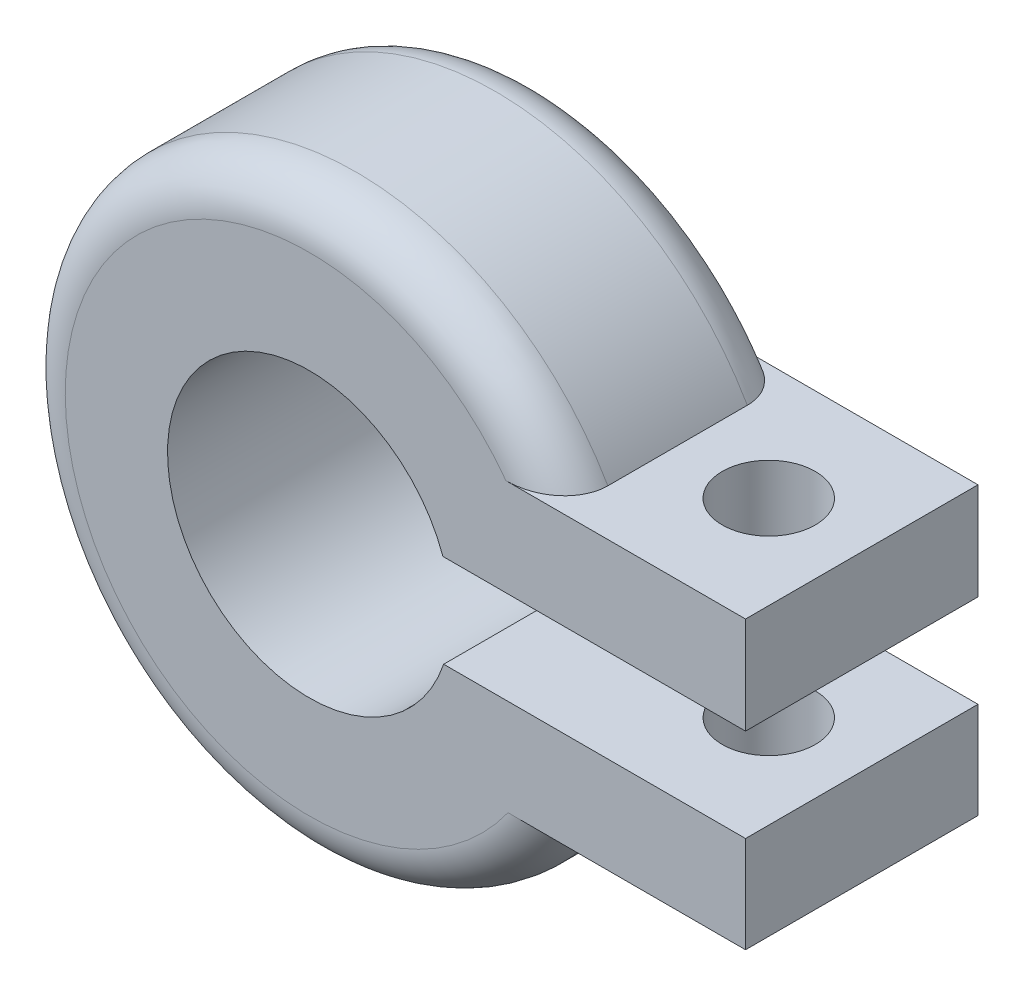
from build123d import *

# Parameters (mm, degrees)
BOSS_EXTRUDE1_DEPTH     = 5
FILLET3_R               = 1
FILLET4_R               = 1
CUT_EXTRUDE1_DEPTH      = 13.854889966
CUT_EXTRUDE1_DEPTH_BACK = 13.854889966
SKETCH2_R               = 1


with BuildPart() as part:
    # Sketch1 → Boss-Extrude1 (new body)
    with BuildSketch(Plane(origin=(0, 0, 0), x_dir=(0, 1, 0), z_dir=(0, 0, 1))):
        with BuildLine():
            Line((-0.977144637, -2.88923664), (-0.977144637, -6.118433409))
            Line((-0.977144637, -6.118433409), (-0.977144637, -9.381714775))
            Line((-0.977144637, -9.381714775), (-3.05, -9.381714775))
            Line((-3.05, -9.381714775), (-3.05, -5.455272679))
            ThreePointArc((-3.05, -5.455272679), (-0.035341977, 6.249900075), (3.1115, -5.420430587))
            Line((3.1115, -5.420430587), (3.1115, -9.381714775))
            Line((3.1115, -9.381714775), (1.022855363, -9.381714775))
            Line((1.022855363, -9.381714775), (1.022855363, -6.104337812))
            Line((1.022855363, -6.104337812), (1.022855363, -2.873372044))
            ThreePointArc((1.022855363, -2.873372044), (-0.024192746, 3.049904049), (-0.977144637, -2.88923664))
        make_face()
    extrude(amount=BOSS_EXTRUDE1_DEPTH)

    # Fillet3
    fillet3_edges = [part.edges().sort_by_distance(p)[0] for p in [
        (-6.249900075, -0.035341977, 5),
    ]]
    fillet(fillet3_edges, radius=FILLET3_R)

    # Fillet4
    fillet4_edges = [part.edges().sort_by_distance(p)[0] for p in [
        (-6.249900075, -0.035341977, 0),
    ]]
    fillet(fillet4_edges, radius=FILLET4_R)

    # Sketch2 → Cut-Extrude1 (cut, two sides: drawn at the far end of the back side and taken through both)
    with BuildSketch(Plane(origin=(0, -0.977144637, 0), x_dir=(-1, 0, 0), z_dir=(0, 1, 0)).offset(-CUT_EXTRUDE1_DEPTH_BACK)):
        with Locations(Location((-7.381714775, 2.5, 0), (0, 0, 180))):
            Circle(SKETCH2_R)
    extrude(amount=CUT_EXTRUDE1_DEPTH + CUT_EXTRUDE1_DEPTH_BACK, mode=Mode.SUBTRACT)


solid = part.part
